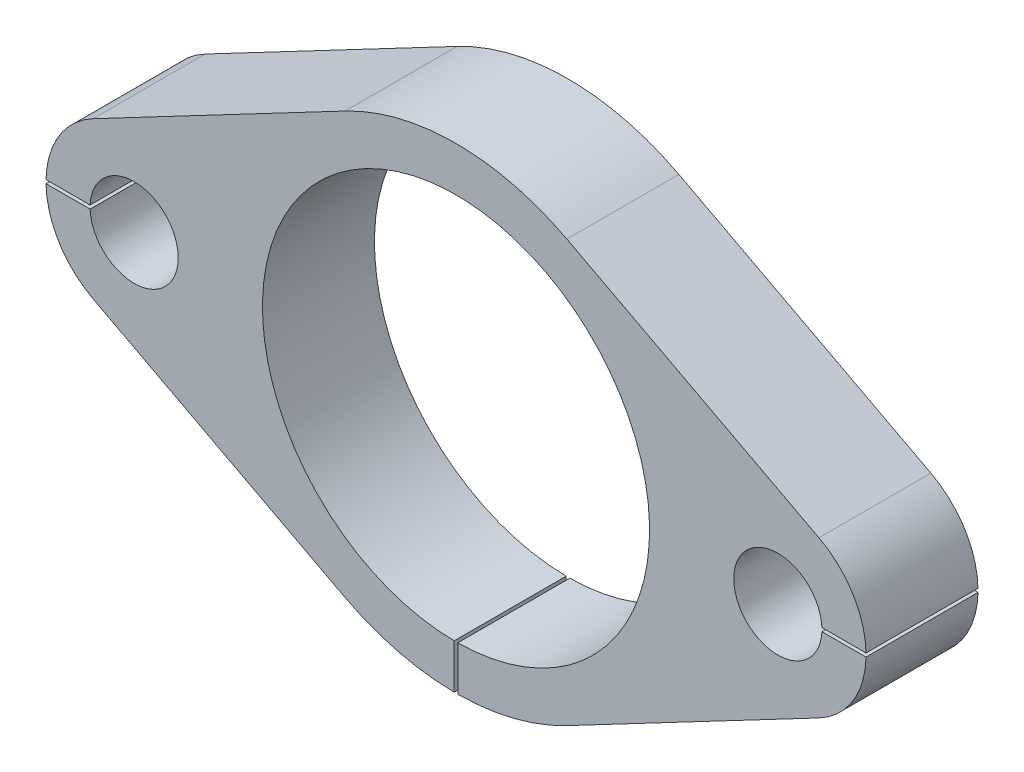
from build123d import *

# Parameters (mm, degrees)
RESSALTO_EXTRUS_O1_DEPTH = 6.35
ESBO_O2_R                = 10.975
ESBO_O2_R_2              = 2.5
CORTE_EXTRUS_O1_DEPTH    = 28.62489819
CORTE_EXTRUS_O2_DEPTH    = 28.62489819
ESBO_O4_W                = 5
ESBO_O4_H                = 0.2
CORTE_EXTRUS_O3_DEPTH    = 28.62489819


with BuildPart() as part:
    # Esboço1 → Ressalto-extrusão1 (new body)
    with BuildSketch(Plane.XY):
        with BuildLine():
            Line((-20.578767123, 4.424572712), (-6.287671233, 11.946346323))
            ThreePointArc((-6.287671233, 11.946346323), (0, 13.5), (6.287671233, 11.946346323))
            Line((6.287671233, 11.946346323), (20.578767123, 4.424572712))
            ThreePointArc((20.578767123, 4.424572712), (23.25, 0), (20.578767123, -4.424572712))
            Line((20.578767123, -4.424572712), (6.287671233, -11.946346323))
            ThreePointArc((6.287671233, -11.946346323), (0, -13.5), (-6.287671233, -11.946346323))
            Line((-6.287671233, -11.946346323), (-20.578767123, -4.424572712))
            ThreePointArc((-20.578767123, -4.424572712), (-23.25, 0), (-20.578767123, 4.424572712))
        make_face()
    extrude(amount=RESSALTO_EXTRUS_O1_DEPTH)

    # Esboço2 → Corte-extrusão1 (cut, through all)
    with BuildSketch(Plane.XY.offset(6.35)):
        Circle(ESBO_O2_R)
        with Locations((-18.25, 0)):
            Circle(ESBO_O2_R_2)
        with Locations((18.25, 0)):
            Circle(ESBO_O2_R_2)
    extrude(amount=-CORTE_EXTRUS_O1_DEPTH, mode=Mode.SUBTRACT)

    # Esboço3 → Corte-extrusão2 (cut, through all)
    with BuildSketch(Plane.XY.offset(6.35)):
        with BuildLine():
            Line((0.1, -10.97454441), (0.1, -13.499629625))
            ThreePointArc((0.1, -13.499629625), (0, -13.5), (-0.1, -13.499629625))
            Line((-0.1, -13.499629625), (-0.1, -10.97454441))
            ThreePointArc((-0.1, -10.97454441), (0, -10.975), (0.1, -10.97454441))
        make_face()
    extrude(amount=-CORTE_EXTRUS_O2_DEPTH, mode=Mode.SUBTRACT)

    # Esboço4 → Corte-extrusão3 (cut, through all)
    with BuildSketch(Plane.XY.offset(6.35)):
        with Locations((-20.75, 0)):
            Rectangle(ESBO_O4_W, ESBO_O4_H)
    corte_extrus_o3 = extrude(amount=-CORTE_EXTRUS_O3_DEPTH, mode=Mode.SUBTRACT)

    # Espelhar1: Corte-extrusão3 across plane
    add(corte_extrus_o3.mirror(Plane(origin=(0, 0, 0), x_dir=(0, 0, 1), z_dir=(1, 0, 0))), mode=Mode.SUBTRACT)


solid = part.part
